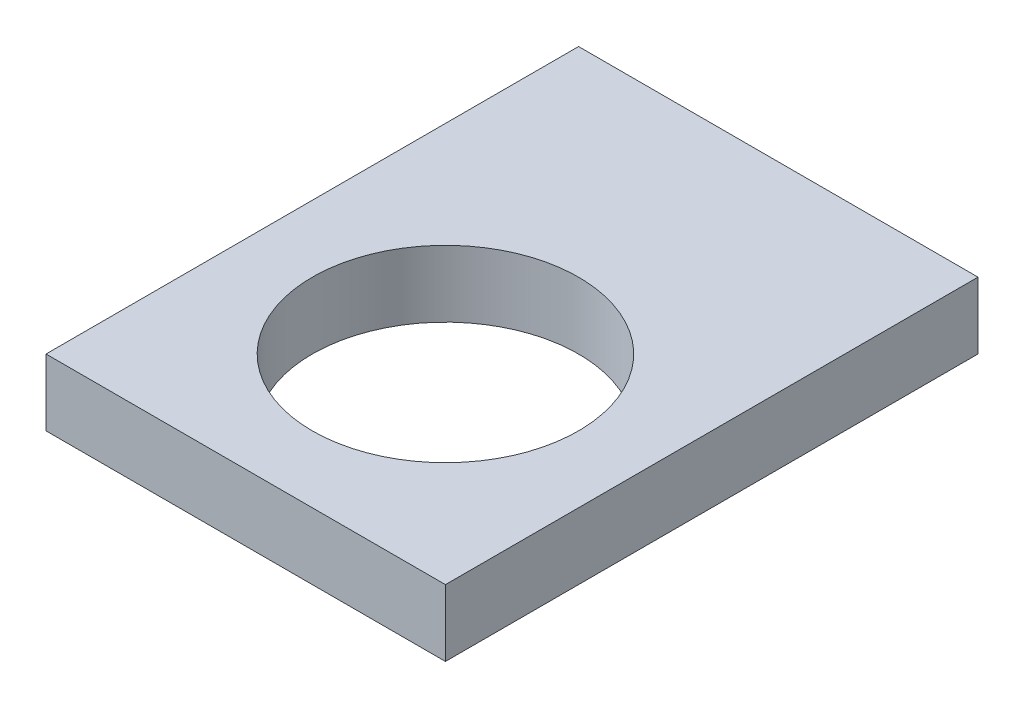
from build123d import *

# Parameters (mm, degrees)
ESQUISSE1_W             = 30
ESQUISSE1_H             = 40
BOSS_EXTRU_1_DEPTH      = 5
ESQUISSE3_R             = 10
ENL_V_MAT_EXTRU_1_DEPTH = 26.495097568


with BuildPart() as part:
    # Esquisse1 → Boss.-Extru.1 (new body)
    with BuildSketch(Plane(origin=(0, 0, 0), x_dir=(1, 0, 0), z_dir=(0, 1, 0))):
        Rectangle(ESQUISSE1_W, ESQUISSE1_H)
    extrude(amount=BOSS_EXTRU_1_DEPTH)

    # Esquisse3 → Enlèv. mat.-Extru.1 (cut, through all)
    with BuildSketch(Plane(origin=(0, 5, 0), x_dir=(1, 0, 0), z_dir=(0, 1, 0))):
        with Locations(Location((0, -5, 0), (0, 0, 270))):
            Circle(ESQUISSE3_R)
    extrude(amount=-ENL_V_MAT_EXTRU_1_DEPTH, mode=Mode.SUBTRACT)


solid = part.part
